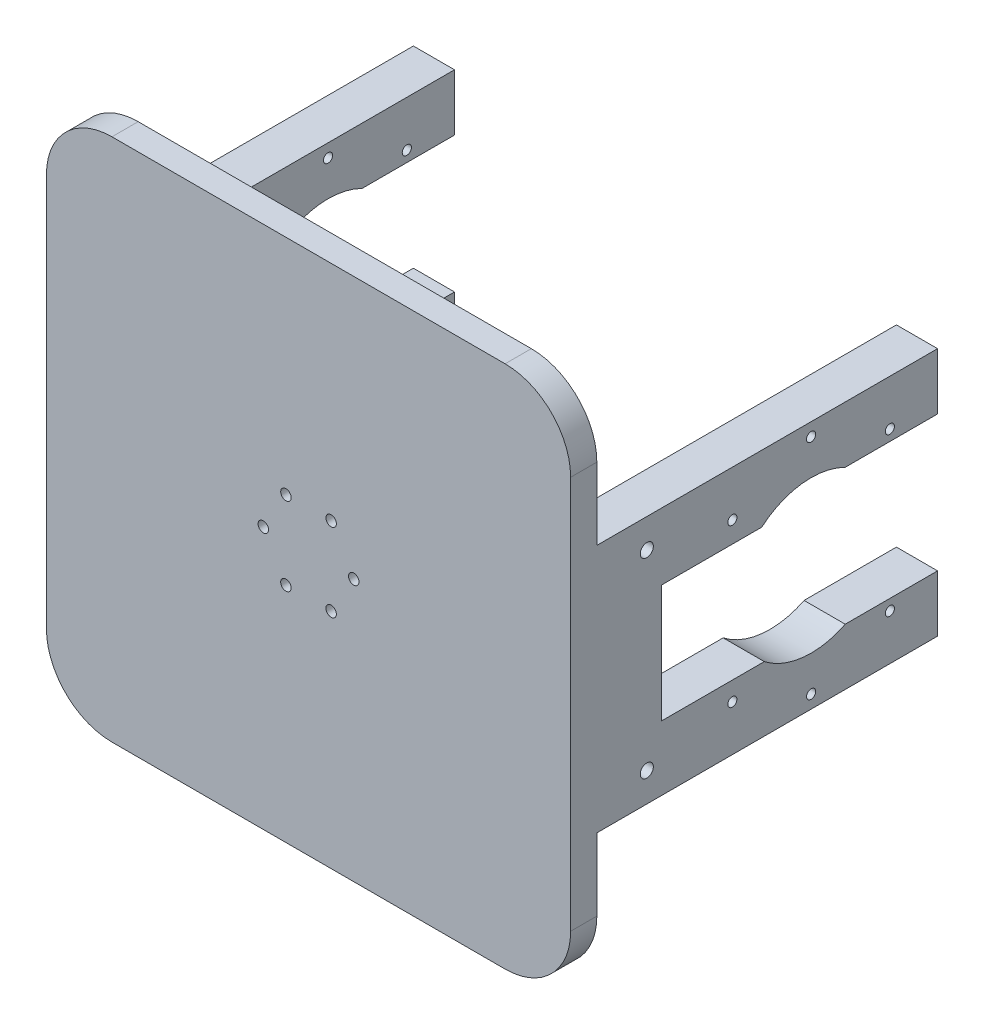
from build123d import *

# Parameters (mm, degrees)
SKETCH_1_W          = 200
SKETCH_1_H          = 200
EXTRUDE_1_DEPTH     = 10
SKETCH_2_W          = 15.7
SKETCH_2_H          = 95
EXTRUDE_2_DEPTH     = 130
SKETCH_3_R          = 1.75
CUT_EXTRUDE_1_DEPTH = 259.650343128
SKETCH_4_R          = 29
CUT_EXTRUDE_2_DEPTH = 500
SKETCH_5_W          = 51.576818731
SKETCH_5_H          = 51.835019378
SKETCH_5_W_2        = 50.790053699
SKETCH_5_H_2        = 44.901224563
CUT_EXTRUDE_3_DEPTH = 259.650343128
SKETCH_6_R          = 2.5
CUT_EXTRUDE_4_DEPTH = 259.650343128
FILLET_1_R          = 25
SKETCH_7_R          = 2
CUT_EXTRUDE_5_DEPTH = 193.093727123


with BuildPart() as part:
    # 草图1 → 凸台-拉伸1 (new body)
    with BuildSketch(Plane.XY):
        Rectangle(SKETCH_1_W, SKETCH_1_H)
    extrude(amount=EXTRUDE_1_DEPTH)

    # 草图2 → 凸台-拉伸2 (add)
    with BuildSketch(Plane(origin=(0, 0, 0), x_dir=(-1, 0, 0), z_dir=(0, 0, -1))):
        with Locations((-92.15, 0)):
            Rectangle(SKETCH_2_W, SKETCH_2_H)
        with Locations((92.15, 0)):
            Rectangle(SKETCH_2_W, SKETCH_2_H)
    extrude(amount=EXTRUDE_2_DEPTH)

    # 草图3 → 切除-拉伸1 (cut, through all)
    with BuildSketch(Plane.ZY.offset(100)):
        with Locations(Location((-81.75, -42.5, 0), (0, 0, 270))):
            Circle(SKETCH_3_R)
        with Locations(Location((-51.6979618, -30.0520382, 0), (0, 0, 270))):
            Circle(SKETCH_3_R)
        with Locations(Location((-39.25, 0, 0), (0, 0, 270))):
            Circle(SKETCH_3_R)
        with Locations(Location((-81.75, 42.5, 0), (0, 0, 270))):
            Circle(SKETCH_3_R)
        with Locations(Location((-111.8020382, 30.0520382, 0), (0, 0, 270))):
            Circle(SKETCH_3_R)
        with Locations(Location((-111.8020382, -30.0520382, 0), (0, 0, 270))):
            Circle(SKETCH_3_R)
        with Locations(Location((-51.6979618, 30.0520382, 0), (0, 0, 270))):
            Circle(SKETCH_3_R)
        with Locations(Location((-124.25, 0, 0), (0, 0, 270))):
            Circle(SKETCH_3_R)
    extrude(amount=-CUT_EXTRUDE_1_DEPTH, mode=Mode.SUBTRACT)

    # 草图4 → 切除-拉伸2 (cut, symmetric)
    with BuildSketch(Plane.ZY.offset(-84.3)):
        with Locations((-81.75, 0)):
            Circle(SKETCH_4_R)
    extrude(amount=CUT_EXTRUDE_2_DEPTH, both=True, mode=Mode.SUBTRACT)

    # 草图5 → 切除-拉伸3 (cut, through all)
    with BuildSketch(Plane(origin=(100, 0, 0), x_dir=(0, 0, -1), z_dir=(1, 0, 0))):
        with Locations((107.073919085, 0)):
            Rectangle(SKETCH_5_W, SKETCH_5_H)
        with Locations((49.973585145, -0.398574081)):
            Rectangle(SKETCH_5_W_2, SKETCH_5_H_2)
    extrude(amount=-CUT_EXTRUDE_3_DEPTH, mode=Mode.SUBTRACT)

    # 草图6 → 切除-拉伸4 (cut, through all)
    with BuildSketch(Plane.ZY.offset(100)):
        with Locations(Location((-19.063545362, -36.423322267, 0), (0, 0, 270))):
            Circle(SKETCH_6_R)
        with Locations((-19.063545362, 36.423322267)):
            Circle(SKETCH_6_R)
    extrude(amount=-CUT_EXTRUDE_4_DEPTH, mode=Mode.SUBTRACT)

    # 圆角1
    fillet_1_edges = [part.edges().sort_by_distance(p)[0] for p in [
        (100, -100, 5),
        (-100, -100, 5),
        (-100, 100, 5),
        (100, 100, 5),
    ]]
    fillet(fillet_1_edges, radius=FILLET_1_R)

    # 草图7 → 切除-拉伸5 (cut, through all)
    with BuildSketch(Plane(origin=(0, 0, 0), x_dir=(-1, 0, 0), z_dir=(0, 0, -1))):
        with Locations((17.25, 0)):
            Circle(SKETCH_7_R)
        with Locations((8.625, -14.938938215)):
            Circle(SKETCH_7_R)
        with Locations((-8.625, -14.938938215)):
            Circle(SKETCH_7_R)
        with Locations((-17.25, 0)):
            Circle(SKETCH_7_R)
        with Locations((-8.625, 14.938938215)):
            Circle(SKETCH_7_R)
        with Locations((8.625, 14.938938215)):
            Circle(SKETCH_7_R)
    extrude(amount=-CUT_EXTRUDE_5_DEPTH, mode=Mode.SUBTRACT)


solid = part.part
